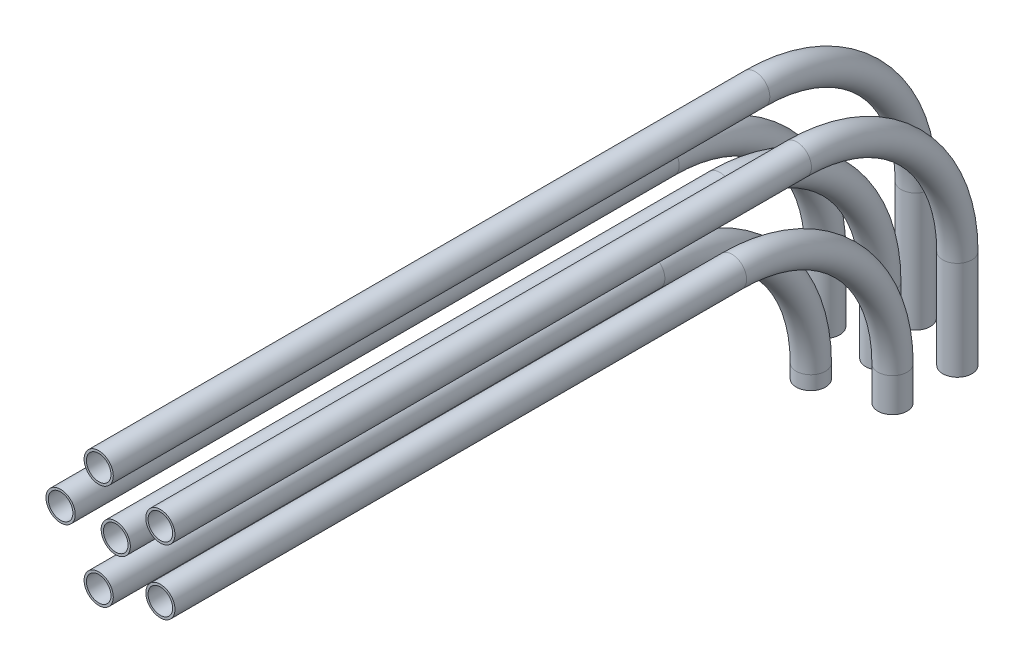
from build123d import *

# Parameters (mm, degrees)
SKETCH1_R              = 3.175
SKETCH1_R_2            = 2.675
ALL_TUBES_HORI_DEPTH   = 120
ALL_TUBES_HORI_2_DEPTH = 120
ALL_TUBES_HORI_3_DEPTH = 120
ALL_TUBES_HORI_4_DEPTH = 120
ALL_TUBES_HORI_5_DEPTH = 120
ALL_TUBES_HORI_6_DEPTH = 120
SKETCH2_R              = 3.175
SKETCH2_R_2            = 2.675
TUBE_1_REVOLVE_ANGLE   = 90
SKETCH3_R              = 3.175
SKETCH3_R_2            = 2.675
TUBE_2_H_EXTRU_DEPTH   = 4.35925517
SKETCH4_R              = 3.175
SKETCH4_R_2            = 2.675
TUBE_2_REVOLVE_ANGLE   = 90
SKETCH5_R              = 3.175
SKETCH5_R_2            = 2.675
TUBE_2_V_EXTRU_DEPTH   = 4.359255168
TUBE_START             = 11.4126782
SKETCH6_R              = 3.175
SKETCH6_R_2            = 2.675
TUBE_3_4_H_EXTRU_DEPTH = 11.4126782
SKETCH7_R              = 3.175
SKETCH7_R_2            = 2.675
TUBE_3_4_REVOLVE_ANGLE = 90
SKETCH8_R              = 3.175
SKETCH8_R_2            = 2.675
TUBE_3_4_V_EXTRU_DEPTH = 11.412678196
SKETCH9_R              = 3.175
SKETCH9_R_2            = 2.675
TUBE_5_H_EXTRU_DEPTH   = 18.46610122
SKETCH10_R             = 3.175
SKETCH10_R_2           = 2.675
TUBE_5_REVOLVE_ANGLE   = 90
SKETCH13_R             = 3.175
SKETCH13_R_2           = 2.675
TUBE_5_V_EXTRU_DEPTH   = 18.466101223
SKETCH11_R             = 3.175
SKETCH11_R_2           = 2.675
TUBE_6_H_EXTRU_DEPTH   = 22.8253564
SKETCH12_R             = 3.175
SKETCH12_R_2           = 2.675
TUBE_6_REVOLVE_ANGLE   = 90
SKETCH14_R             = 3.175
SKETCH14_R_2           = 2.675
TUBE_6_V_EXTRU_DEPTH   = 22.825356391
SKETCH15_R             = 3.175
SKETCH15_R_2           = 2.675
ALL_TUBES_VERT_DEPTH   = 3


with BuildPart() as part:
    # Sketch1 → All Tubes Hori (new body)
    with BuildSketch(Plane.XY):
        Circle(SKETCH1_R)
        Circle(SKETCH1_R_2, mode=Mode.SUBTRACT)
    extrude(amount=ALL_TUBES_HORI_DEPTH)



with BuildPart() as body_2:
    # Sketch1 → All Tubes Hori 2 (new body)
    with BuildSketch(Plane.XY):
        with Locations((-12, 0)):
            Circle(SKETCH1_R)
        with Locations((-12, 0)):
            Circle(SKETCH1_R_2, mode=Mode.SUBTRACT)
    extrude(amount=ALL_TUBES_HORI_2_DEPTH)


with BuildPart() as body_3:
    # Sketch1 → All Tubes Hori 3 (new body)
    with BuildSketch(Plane.XY):
        with Locations((-3.708203932, 11.412678196)):
            Circle(SKETCH1_R)
        with Locations((-3.708203932, 11.412678196)):
            Circle(SKETCH1_R_2, mode=Mode.SUBTRACT)
    extrude(amount=ALL_TUBES_HORI_3_DEPTH)

    # Sketch11 → Tube 6 H Extru (add)
    with BuildSketch(Plane(origin=(0, 0, 0), x_dir=(-1, 0, 0), z_dir=(0, 0, -1))):
        with Locations((3.708203932, 11.412678196)):
            Circle(SKETCH11_R)
        with Locations((3.708203932, 11.412678196)):
            Circle(SKETCH11_R_2, mode=Mode.SUBTRACT)
    extrude(amount=TUBE_6_H_EXTRU_DEPTH)

    # Sketch12 → Tube 6 Revolve (revolve)
    with BuildSketch(Plane(origin=(0, 0, -22.8253564), x_dir=(-1, 0, 0), z_dir=(0, 0, -1))):
        with Locations(Location((3.708203932, 11.412678196, 0), (0, 0, 90))):
            Circle(SKETCH12_R)
        with Locations(Location((3.708203932, 11.412678196, 0), (0, 0, 90))):
            Circle(SKETCH12_R_2, mode=Mode.SUBTRACT)
    revolve(axis=Axis((21.850329766, -23.512321804, -22.8253564), (-1, 0, 0)), revolution_arc=TUBE_6_REVOLVE_ANGLE)

    # Sketch14 → Tube 6 V Extru (add)
    with BuildSketch(Plane.XZ.offset(23.512321804)):
        with Locations(Location((-3.708203932, -57.7503564, 0), (0, 0, 270))):
            Circle(SKETCH14_R)
        with Locations(Location((-3.708203932, -57.7503564, 0), (0, 0, 270))):
            Circle(SKETCH14_R_2, mode=Mode.SUBTRACT)
    extrude(amount=TUBE_6_V_EXTRU_DEPTH)


with BuildPart() as body_4:
    # Sketch1 → All Tubes Hori 4 (new body)
    with BuildSketch(Plane.XY):
        with Locations((9.708203932, 7.053423028)):
            Circle(SKETCH1_R)
        with Locations((9.708203932, 7.053423028)):
            Circle(SKETCH1_R_2, mode=Mode.SUBTRACT)
    extrude(amount=ALL_TUBES_HORI_4_DEPTH)

    # Sketch9 → Tube 5 H Extru (add)
    with BuildSketch(Plane(origin=(0, 0, 0), x_dir=(-1, 0, 0), z_dir=(0, 0, -1))):
        with Locations((-9.708203932, 7.053423028)):
            Circle(SKETCH9_R)
        with Locations((-9.708203932, 7.053423028)):
            Circle(SKETCH9_R_2, mode=Mode.SUBTRACT)
    extrude(amount=TUBE_5_H_EXTRU_DEPTH)

    # Sketch10 → Tube 5 Revolve (revolve)
    with BuildSketch(Plane(origin=(0, 0, -18.46610122), x_dir=(-1, 0, 0), z_dir=(0, 0, -1))):
        with Locations(Location((-9.708203932, 7.053423028, 0), (0, 0, 90))):
            Circle(SKETCH10_R)
        with Locations(Location((-9.708203932, 7.053423028, 0), (0, 0, 90))):
            Circle(SKETCH10_R_2, mode=Mode.SUBTRACT)
    revolve(axis=Axis((23.434648655, -27.871576972, -18.46610122), (-1, 0, 0)), revolution_arc=TUBE_5_REVOLVE_ANGLE)

    # Sketch13 → Tube 5 V Extru (add)
    with BuildSketch(Plane.XZ.offset(27.871576972)):
        with Locations(Location((9.708203932, -53.39110122, 0), (0, 0, 270))):
            Circle(SKETCH13_R)
        with Locations(Location((9.708203932, -53.39110122, 0), (0, 0, 270))):
            Circle(SKETCH13_R_2, mode=Mode.SUBTRACT)
    extrude(amount=TUBE_5_V_EXTRU_DEPTH)


with BuildPart() as body_5:
    # Sketch1 → All Tubes Hori 5 (new body)
    with BuildSketch(Plane.XY):
        with Locations((9.708203932, -7.053423028)):
            Circle(SKETCH1_R)
        with Locations((9.708203932, -7.053423028)):
            Circle(SKETCH1_R_2, mode=Mode.SUBTRACT)
    extrude(amount=ALL_TUBES_HORI_5_DEPTH)

    # Sketch3 → Tube 2 H Extru (add)
    with BuildSketch(Plane(origin=(0, 0, 0), x_dir=(-1, 0, 0), z_dir=(0, 0, -1))):
        with Locations((-9.708203932, -7.053423028)):
            Circle(SKETCH3_R)
        with Locations((-9.708203932, -7.053423028)):
            Circle(SKETCH3_R_2, mode=Mode.SUBTRACT)
    extrude(amount=TUBE_2_H_EXTRU_DEPTH)

    # Sketch4 → Tube 2 Revolve (revolve)
    with BuildSketch(Plane(origin=(0, 0, -4.35925517), x_dir=(-1, 0, 0), z_dir=(0, 0, -1))):
        with Locations(Location((-9.708203932, -7.053423028, 0), (0, 0, 90))):
            Circle(SKETCH4_R)
        with Locations(Location((-9.708203932, -7.053423028, 0), (0, 0, 90))):
            Circle(SKETCH4_R_2, mode=Mode.SUBTRACT)
    revolve(axis=Axis((15.623479427, -41.978423028, -4.35925517), (-1, 0, 0)), revolution_arc=TUBE_2_REVOLVE_ANGLE)

    # Sketch5 → Tube 2 V Extru (add)
    with BuildSketch(Plane.XZ.offset(41.978423028)):
        with Locations(Location((9.708203932, -39.28425517, 0), (0, 0, 270))):
            Circle(SKETCH5_R)
        with Locations(Location((9.708203932, -39.28425517, 0), (0, 0, 270))):
            Circle(SKETCH5_R_2, mode=Mode.SUBTRACT)
    extrude(amount=TUBE_2_V_EXTRU_DEPTH)


with BuildPart() as body_6:
    # Sketch1 → All Tubes Hori 6 (new body)
    with BuildSketch(Plane.XY):
        with Locations((-3.708203932, -11.412678196)):
            Circle(SKETCH1_R)
        with Locations((-3.708203932, -11.412678196)):
            Circle(SKETCH1_R_2, mode=Mode.SUBTRACT)
    extrude(amount=ALL_TUBES_HORI_6_DEPTH)

    # Sketch2 → Tube 1 Revolve (revolve)
    with BuildSketch(Plane(origin=(0, 0, 0), x_dir=(-1, 0, 0), z_dir=(0, 0, -1))):
        with Locations(Location((3.708203932, -11.412678196, 0), (0, 0, 90))):
            Circle(SKETCH2_R)
        with Locations(Location((3.708203932, -11.412678196, 0), (0, 0, 90))):
            Circle(SKETCH2_R_2, mode=Mode.SUBTRACT)
    revolve(axis=Axis((6.957036887, -46.337678196, 0), (-1, 0, 0)), revolution_arc=TUBE_1_REVOLVE_ANGLE)


with BuildPart() as part_1:
    add(part.part)

    add(body_2.part)  # Tube 3 & 4 H Extru merges body 2
    # Sketch6 → Tube 3 & 4 H Extru (add)
    # profile 1 of 2: a face of its own
    with BuildSketch(Plane(origin=(0, 0, 0), x_dir=(-1, 0, 0), z_dir=(0, 0, -1)).offset(TUBE_START)):
        with Locations((12, 0)):
            Circle(SKETCH6_R)
        with Locations((12, 0)):
            Circle(SKETCH6_R_2, mode=Mode.SUBTRACT)
    # profile 2 of 2: a face of its own
    with BuildSketch(Plane(origin=(0, 0, 0), x_dir=(-1, 0, 0), z_dir=(0, 0, -1)).offset(TUBE_START)):
        Circle(SKETCH6_R)
        Circle(SKETCH6_R_2, mode=Mode.SUBTRACT)
    extrude(amount=-TUBE_3_4_H_EXTRU_DEPTH)

    # Sketch7 → Tube 3 & 4 Revolve (revolve)
    # profile 1 of 2: a face of its own
    with BuildSketch(Plane(origin=(0, 0, -11.4126782), x_dir=(-1, 0, 0), z_dir=(0, 0, -1))):
        with Locations(Location((12, 0, 0), (0, 0, 90))):
            Circle(SKETCH7_R)
        with Locations(Location((12, 0, 0), (0, 0, 90))):
            Circle(SKETCH7_R_2, mode=Mode.SUBTRACT)
    # profile 2 of 2: a face of its own
    with BuildSketch(Plane(origin=(0, 0, -11.4126782), x_dir=(-1, 0, 0), z_dir=(0, 0, -1))):
        with Locations(Location((0, 0, 0), (0, 0, 90))):
            Circle(SKETCH7_R)
        with Locations(Location((0, 0, 0), (0, 0, 90))):
            Circle(SKETCH7_R_2, mode=Mode.SUBTRACT)
    revolve(axis=Axis((-24.421398886, -34.925, -11.4126782), (-1, 0, 0)), revolution_arc=TUBE_3_4_REVOLVE_ANGLE)

    # Sketch8 → Tube 3 & 4 V Extru (add)
    # profile 1 of 2: a face of its own
    with BuildSketch(Plane.XZ.offset(34.925)):
        with Locations(Location((-12, -46.3376782, 0), (0, 0, 270))):
            Circle(SKETCH8_R)
        with Locations(Location((-12, -46.3376782, 0), (0, 0, 270))):
            Circle(SKETCH8_R_2, mode=Mode.SUBTRACT)
    # profile 2 of 2: a face of its own
    with BuildSketch(Plane.XZ.offset(34.925)):
        with Locations(Location((0, -46.3376782, 0), (0, 0, 270))):
            Circle(SKETCH8_R)
        with Locations(Location((0, -46.3376782, 0), (0, 0, 270))):
            Circle(SKETCH8_R_2, mode=Mode.SUBTRACT)
    extrude(amount=TUBE_3_4_V_EXTRU_DEPTH)


    add(body_3.part)  # All Tubes Vert merges body 3

    add(body_4.part)  # All Tubes Vert merges body 4

    add(body_5.part)  # All Tubes Vert merges body 5

    add(body_6.part)  # All Tubes Vert merges body 6
    # Sketch15 → All Tubes Vert (add)
    # profile 1 of 6: a face of its own
    with BuildSketch(Plane.XZ.offset(46.337678196)):
        with Locations(Location((-3.708203932, -34.925, 0), (0, 0, 270))):
            Circle(SKETCH15_R)
        with Locations(Location((-3.708203932, -34.925, 0), (0, 0, 270))):
            Circle(SKETCH15_R_2, mode=Mode.SUBTRACT)
    # profile 2 of 6: a face of its own
    with BuildSketch(Plane.XZ.offset(46.337678196)):
        with Locations(Location((9.708203932, -39.28425517, 0), (0, 0, 270))):
            Circle(SKETCH15_R)
        with Locations(Location((9.708203932, -39.28425517, 0), (0, 0, 270))):
            Circle(SKETCH15_R_2, mode=Mode.SUBTRACT)
    # profile 3 of 6: a face of its own
    with BuildSketch(Plane.XZ.offset(46.337678196)):
        with Locations(Location((9.708203932, -53.39110122, 0), (0, 0, 270))):
            Circle(SKETCH15_R)
        with Locations(Location((9.708203932, -53.39110122, 0), (0, 0, 270))):
            Circle(SKETCH15_R_2, mode=Mode.SUBTRACT)
    # profile 4 of 6: a face of its own
    with BuildSketch(Plane.XZ.offset(46.337678196)):
        with Locations(Location((-3.708203932, -57.7503564, 0), (0, 0, 270))):
            Circle(SKETCH15_R)
        with Locations(Location((-3.708203932, -57.7503564, 0), (0, 0, 270))):
            Circle(SKETCH15_R_2, mode=Mode.SUBTRACT)
    # profile 5 of 6: a face of its own
    with BuildSketch(Plane.XZ.offset(46.337678196)):
        with Locations(Location((-12, -46.3376782, 0), (0, 0, 270))):
            Circle(SKETCH15_R)
        with Locations(Location((-12, -46.3376782, 0), (0, 0, 270))):
            Circle(SKETCH15_R_2, mode=Mode.SUBTRACT)
    # profile 6 of 6: a face of its own
    with BuildSketch(Plane.XZ.offset(46.337678196)):
        with Locations(Location((0, -46.3376782, 0), (0, 0, 270))):
            Circle(SKETCH15_R)
        with Locations(Location((0, -46.3376782, 0), (0, 0, 270))):
            Circle(SKETCH15_R_2, mode=Mode.SUBTRACT)
    extrude(amount=ALL_TUBES_VERT_DEPTH)


solid = part_1.part
